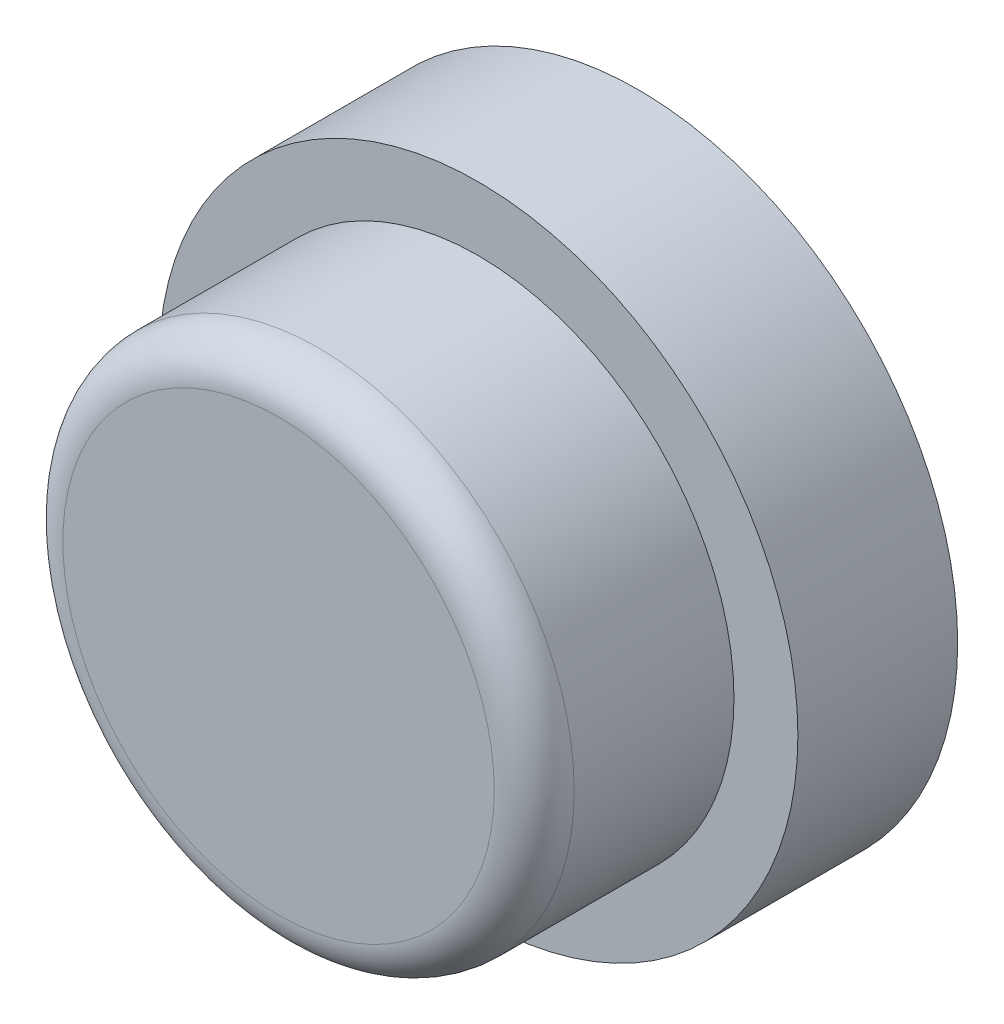
from build123d import *


with BuildPart() as part:
    # Sketch1 → Revolve1 (revolve)
    with BuildSketch(Plane(origin=(0, 0, 0), x_dir=(1, 0, 0), z_dir=(0, 1, 0))):
        with BuildLine():
            Line((0, 0), (5.4, 0))
            ThreePointArc((5.4, 0), (6.107106781, 0.292893219), (6.4, 1))
            Line((6.4, 1), (6.4, 5))
            Line((6.4, 5), (8, 5))
            Line((8, 5), (8, 9))
            Line((8, 9), (2.828427125, 9))
            ThreePointArc((2.828427125, 9), (1.732050808, 10.449489743), (0, 11))
            Line((0, 11), (0, 0))
        make_face()
    revolve(axis=Axis((0, 0, 0), (0, 0, -1)))


solid = part.part
